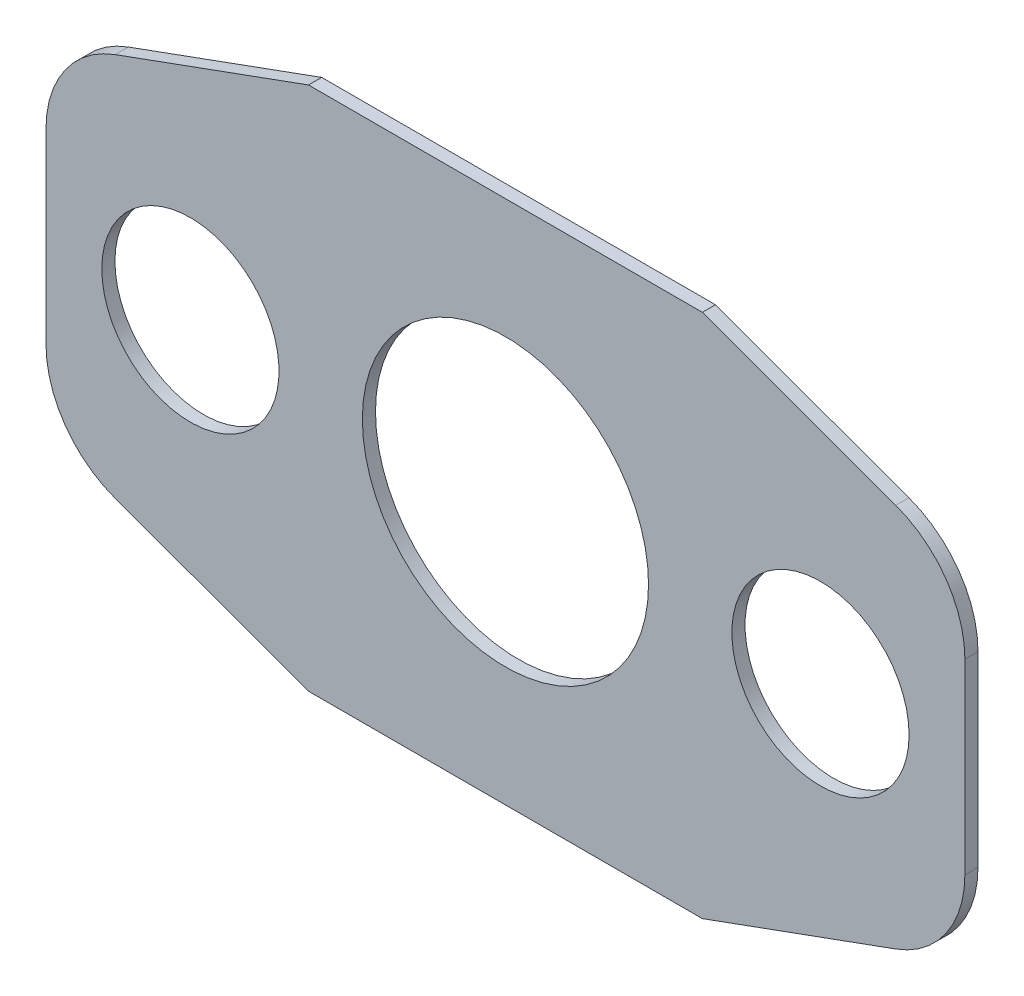
from build123d import *

# Parameters (mm, degrees)
SKETCH1_R           = 10.9
SKETCH1_R_2         = 6.75
BOSS_EXTRUDE1_DEPTH = 1


with BuildPart() as part:
    # Sketch1 → Boss-Extrude1 (new body)
    with BuildSketch(Plane.XY):
        with BuildLine():
            Line((-15, 20), (15, 20))
            Line((15, 20), (29.736161147, 14.636475975))
            ThreePointArc((29.736161147, 14.636475975), (33.553216354, 11.7075465), (35, 7.118935009))
            Line((35, 7.118935009), (35, -7.118935009))
            ThreePointArc((35, -7.118935009), (33.553216354, -11.7075465), (29.736161147, -14.636475975))
            Line((29.736161147, -14.636475975), (15, -20))
            Line((15, -20), (-15, -20))
            Line((-15, -20), (-29.736161147, -14.636475975))
            ThreePointArc((-29.736161147, -14.636475975), (-33.553216354, -11.7075465), (-35, -7.118935009))
            Line((-35, -7.118935009), (-35, 7.118935009))
            ThreePointArc((-35, 7.118935009), (-33.553216354, 11.7075465), (-29.736161147, 14.636475975))
            Line((-29.736161147, 14.636475975), (-15, 20))
        make_face()
        Circle(SKETCH1_R, mode=Mode.SUBTRACT)
        with Locations((24, 0)):
            Circle(SKETCH1_R_2, mode=Mode.SUBTRACT)
        with Locations(Location((-24, 0, 0), (0, 0, 180))):
            Circle(SKETCH1_R_2, mode=Mode.SUBTRACT)
    extrude(amount=-BOSS_EXTRUDE1_DEPTH)


solid = part.part
